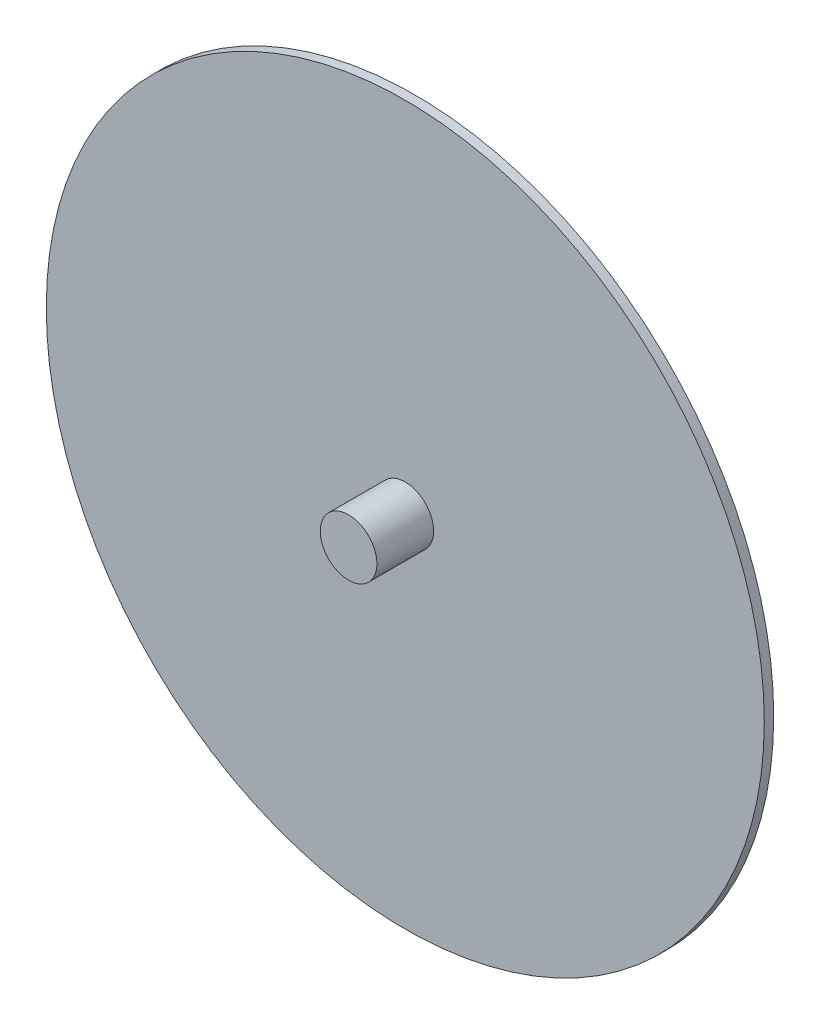
from build123d import *

# Parameters (mm, degrees)
SKETCH_1_R      = 380
EXTRUDE_1_DEPTH = 10
SKETCH_2_R      = 30
EXTRUDE_2_DEPTH = 60


with BuildPart() as part:
    # 草图1 → 凸台-拉伸1 (new body)
    with BuildSketch(Plane.XY):
        Circle(SKETCH_1_R)
    extrude(amount=EXTRUDE_1_DEPTH)

    # 草图2 → 凸台-拉伸2 (add)
    with BuildSketch(Plane.XY.offset(10)):
        Circle(SKETCH_2_R)
    extrude(amount=EXTRUDE_2_DEPTH)


solid = part.part
